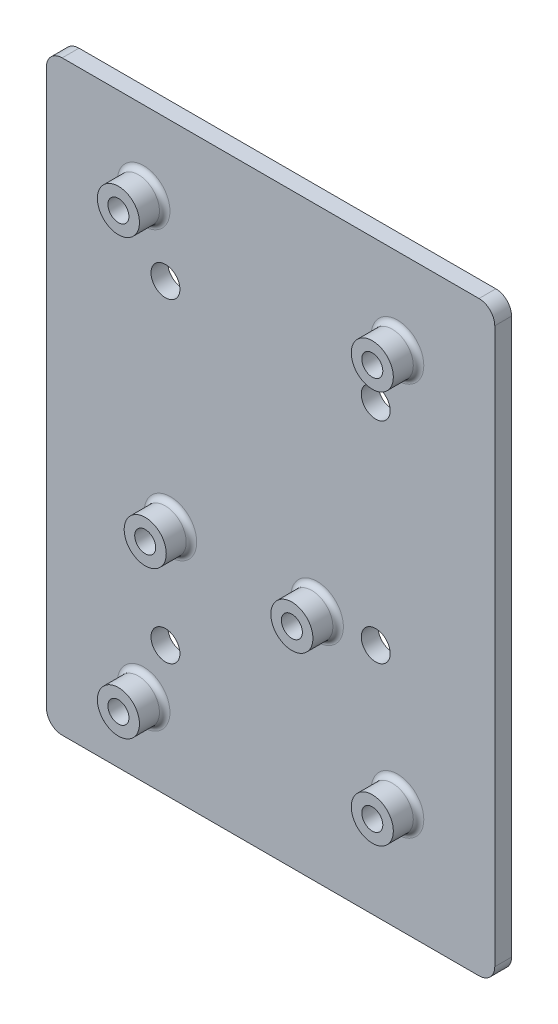
from build123d import *

# Parameters (mm, degrees)
SKETCH1_W             = 85.3
SKETCH1_H             = 111.6
SKETCH1_R             = 2
BASE_PLATE_DEPTH      = 3.2
SKETCH2_R             = 4
SKETCH2_R_2           = 2
INSERTSTANDOFFS_DEPTH = 4.8
MOUNTHOLES_DEPTH      = 92.208168494
MOUNTHOLES_DEPTH_BACK = 92.208168494
SKETCH3_R             = 2.75
FILLET1_R             = 3
FILLET2_R             = 1


with BuildPart() as part:
    # Sketch1 → Base Plate (new body)
    # profile 1 of 2: a face of its own
    with BuildSketch(Plane.XY):
        with Locations((19.05, 11.2)):
            Rectangle(SKETCH1_W, SKETCH1_H)
        Polygon((44.073654403, -33.1), (45.7, -31.473654403), (45.7, 66), (-7.6, 66), (-7.6, -33.1), (-5.1, -33.1), (-2.6, -35.6), (30.4, -35.6), (32.9, -33.1), align=None, mode=Mode.SUBTRACT)
    # profile 2 of 2: a face of its own
    with BuildSketch(Plane.XY):
        Polygon((32.9, -33.1), (44.073654403, -33.1), (45.7, -31.473654403), (45.7, 66), (-7.6, 66), (-7.6, -33.1), (-5.1, -33.1), (-2.6, -35.6), (30.4, -35.6), align=None)
        with Locations((43.2, -24.1)):
            Circle(SKETCH1_R, mode=Mode.SUBTRACT)
        with Locations((-5.1, -30.6)):
            Circle(SKETCH1_R, mode=Mode.SUBTRACT)
        with Locations((27.9, 0)):
            Circle(SKETCH1_R, mode=Mode.SUBTRACT)
        Circle(SKETCH1_R, mode=Mode.SUBTRACT)
        with Locations((43.2, 50.7)):
            Circle(SKETCH1_R, mode=Mode.SUBTRACT)
        with Locations((-5.1, 52)):
            Circle(SKETCH1_R, mode=Mode.SUBTRACT)
    extrude(amount=BASE_PLATE_DEPTH)

    # Sketch2 → InsertStandoffs (add)
    # profile 1 of 6: a face of its own
    with BuildSketch(Plane.XY.offset(3.2)):
        with Locations((-5.1, 52)):
            Circle(SKETCH2_R)
        with Locations((-5.1, 52)):
            Circle(SKETCH2_R_2, mode=Mode.SUBTRACT)
    # profile 2 of 6: a face of its own
    with BuildSketch(Plane.XY.offset(3.2)):
        with Locations((43.2, 50.7)):
            Circle(SKETCH2_R)
        with Locations((43.2, 50.7)):
            Circle(SKETCH2_R_2, mode=Mode.SUBTRACT)
    # profile 3 of 6: a face of its own
    with BuildSketch(Plane.XY.offset(3.2)):
        with Locations((27.9, 0)):
            Circle(SKETCH2_R)
        with Locations((27.9, 0)):
            Circle(SKETCH2_R_2, mode=Mode.SUBTRACT)
    # profile 4 of 6: a face of its own
    with BuildSketch(Plane.XY.offset(3.2)):
        Circle(SKETCH2_R)
        Circle(SKETCH2_R_2, mode=Mode.SUBTRACT)
    # profile 5 of 6: a face of its own
    with BuildSketch(Plane.XY.offset(3.2)):
        with Locations((-5.1, -30.6)):
            Circle(SKETCH2_R)
        with Locations((-5.1, -30.6)):
            Circle(SKETCH2_R_2, mode=Mode.SUBTRACT)
    # profile 6 of 6: a face of its own
    with BuildSketch(Plane.XY.offset(3.2)):
        with Locations((43.2, -24.1)):
            Circle(SKETCH2_R)
        with Locations((43.2, -24.1)):
            Circle(SKETCH2_R_2, mode=Mode.SUBTRACT)
    extrude(amount=INSERTSTANDOFFS_DEPTH)

    # Sketch3 → MountHoles (cut, two sides: drawn at the far end of the back side and taken through both)
    with BuildSketch(Plane.XY.offset(3.2).offset(-MOUNTHOLES_DEPTH_BACK)):
        with Locations((-0.95, 40.05)):
            Circle(SKETCH3_R)
        with Locations((39.05, 40.05)):
            Circle(SKETCH3_R)
        with Locations((39.05, 0.05)):
            Circle(SKETCH3_R)
        with Locations((-0.95, -19.95)):
            Circle(SKETCH3_R)
    extrude(amount=MOUNTHOLES_DEPTH + MOUNTHOLES_DEPTH_BACK, mode=Mode.SUBTRACT)

    # Fillet1
    fillet1_edges = [part.edges().sort_by_distance(p)[0] for p in [
        (-23.6, 67, 1.6),
        (61.7, 67, 1.6),
        (61.7, -44.6, 1.6),
        (-23.6, -44.6, 1.6),
    ]]
    fillet(fillet1_edges, radius=FILLET1_R)

    # Fillet2
    fillet2_edges = [part.edges().sort_by_distance(p)[0] for p in [
        (39.2, 50.7, 3.2),
        (23.9, 0, 3.2),
        (-4, 0, 3.2),
        (-9.1, -30.6, 3.2),
        (39.2, -24.1, 3.2),
        (-9.1, 52, 3.2),
    ]]
    fillet(fillet2_edges, radius=FILLET2_R)


solid = part.part
